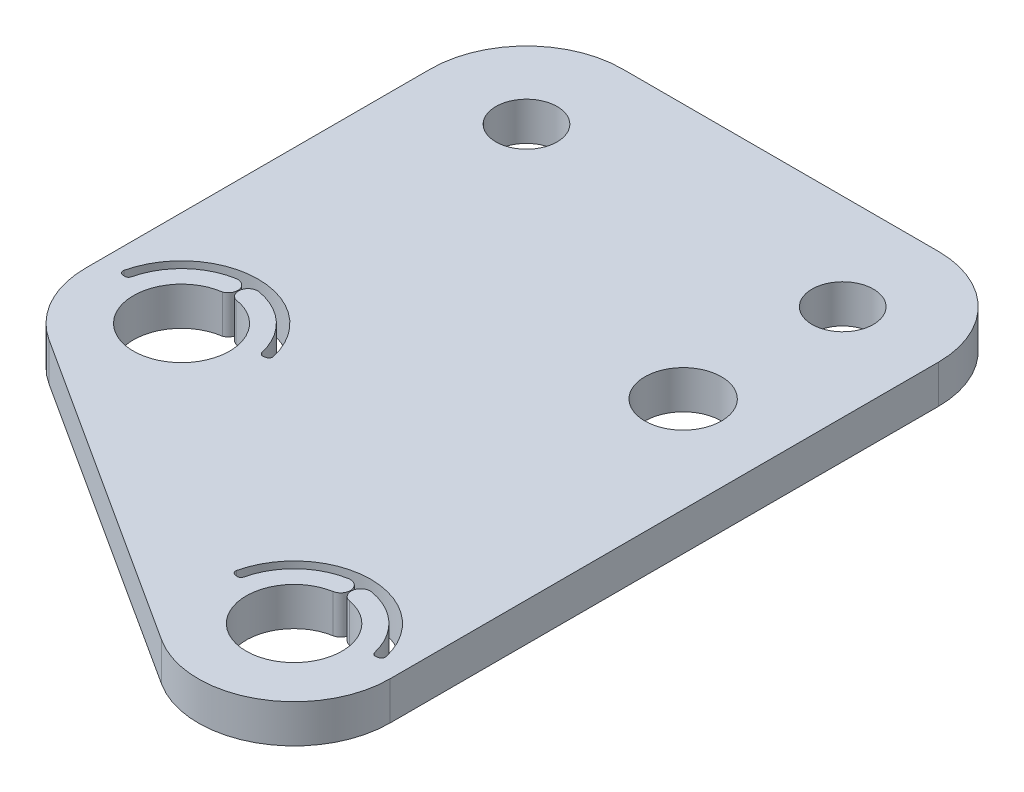
from build123d import *

# Parameters (mm, degrees)
SKETCH1_R           = 2.51
SKETCH1_R_2         = 2.5
SKETCH1_R_3         = 1.6
SKETCH1_R_4         = 2
BOSS_EXTRUDE1_DEPTH = 2
FILLET1_R           = 5
CUT_EXTRUDE2_DEPTH  = 47.884332404
SKETCH3_W           = 0.508814103
SKETCH3_H           = 0.135683761
CUT_EXTRUDE3_DEPTH  = 0.4


with BuildPart() as part:
    # Sketch1 → Boss-Extrude1 (new body)
    with BuildSketch(Plane(origin=(0, 0, 0), x_dir=(1, 0, 0), z_dir=(0, 1, 0))):
        Polygon((0, 0), (26.5, 0), (26.5, -42.791666667), (0, -25.727272727), align=None)
        with Locations(Location((5, -23, 0), (0, 0, 270))):
            Circle(SKETCH1_R, mode=Mode.SUBTRACT)
        with Locations(Location((21.5, -33.625, 0), (0, 0, 270))):
            Circle(SKETCH1_R_2, mode=Mode.SUBTRACT)
        with Locations(Location((21.5, -5, 0), (0, 0, 270))):
            Circle(SKETCH1_R_3, mode=Mode.SUBTRACT)
        with Locations(Location((5, -5, 0), (0, 0, 270))):
            Circle(SKETCH1_R_3, mode=Mode.SUBTRACT)
        with Locations(Location((21.5, -13.325, 0), (0, 0, 270))):
            Circle(SKETCH1_R_4, mode=Mode.SUBTRACT)
    extrude(amount=BOSS_EXTRUDE1_DEPTH)

    # Fillet1
    fillet1_edges = [part.edges().sort_by_distance(p)[0] for p in [
        (0, 1, 0),
        (26.5, 1, 0),
        (26.5, 1, 42.791666667),
        (0, 1, 25.727272727),
    ]]
    fillet(fillet1_edges, radius=FILLET1_R)

    # Sketch2 → Cut-Extrude2 (cut, through all)
    with BuildSketch(Plane(origin=(0, 2, 0), x_dir=(1, 0, 0), z_dir=(0, 1, 0))):
        with BuildLine():
            Line((17.861538493, -32.983441068), (17.762917332, -32.966051496))
            ThreePointArc((17.762917332, -32.966051496), (17.630853466, -32.879452656), (17.602786281, -32.724042048))
            ThreePointArc((17.602786281, -32.724042048), (21.5, -29.625), (25.397213719, -32.724042048))
            ThreePointArc((25.397213719, -32.724042048), (25.369146534, -32.879452656), (25.237082668, -32.966051496))
            Line((25.237082668, -32.966051496), (25.138461507, -32.983441068))
            ThreePointArc((25.138461507, -32.983441068), (24.993487988, -32.953351583), (24.908935554, -32.831804949))
            ThreePointArc((24.908935554, -32.831804949), (23.907056069, -31.084118051), (22.107768622, -30.178172864))
            ThreePointArc((22.107768622, -30.178172864), (21.528540656, -30.583752652), (21.934120444, -31.162980617))
            ThreePointArc((21.934120444, -31.162980617), (21.5, -31.125), (21.065879556, -31.162980617))
            ThreePointArc((21.065879556, -31.162980617), (21.471459344, -30.583752652), (20.892231378, -30.178172864))
            ThreePointArc((20.892231378, -30.178172864), (19.092943931, -31.084118051), (18.091064446, -32.831804949))
            ThreePointArc((18.091064446, -32.831804949), (18.006512012, -32.953351583), (17.861538493, -32.983441068))
        make_face()
        with BuildLine():
            Line((1.361538493, -22.358441068), (1.262917332, -22.341051496))
            ThreePointArc((1.262917332, -22.341051496), (1.130853466, -22.254452656), (1.102786281, -22.099042048))
            ThreePointArc((1.102786281, -22.099042048), (5, -19), (8.897213719, -22.099042048))
            ThreePointArc((8.897213719, -22.099042048), (8.869146534, -22.254452656), (8.737082668, -22.341051496))
            Line((8.737082668, -22.341051496), (8.638461507, -22.358441068))
            ThreePointArc((8.638461507, -22.358441068), (8.493487988, -22.328351583), (8.408935554, -22.206804949))
            ThreePointArc((8.408935554, -22.206804949), (7.407056069, -20.459118051), (5.607768622, -19.553172864))
            ThreePointArc((5.607768622, -19.553172864), (5.028540656, -19.958752652), (5.434120444, -20.537980617))
            ThreePointArc((5.434120444, -20.537980617), (5, -20.5), (4.565879556, -20.537980617))
            ThreePointArc((4.565879556, -20.537980617), (4.971459344, -19.958752652), (4.392231378, -19.553172864))
            ThreePointArc((4.392231378, -19.553172864), (2.592943931, -20.459118051), (1.591064446, -22.206804949))
            ThreePointArc((1.591064446, -22.206804949), (1.506512012, -22.328351583), (1.361538493, -22.358441068))
        make_face()
    extrude(amount=-CUT_EXTRUDE2_DEPTH, mode=Mode.SUBTRACT)

    # Sketch3 → Cut-Extrude3 (cut)
    # profile 1 of 6: a face of its own
    with BuildSketch(Plane(origin=(0, 0, 0), x_dir=(-1, 0, 0), z_dir=(0, 0, -1))):
        Polygon((-16.413127671, 0.4), (-16.238487831, 1.722916667), (-16.22152736, 1.722916667), (-15.675347222, 0.637446581), (-15.130492121, 1.722916667), (-15.113266643, 1.722916667), (-14.937566774, 0.4), (-15.056820079, 0.4), (-15.18349359, 1.351906384), (-15.661036826, 0.4), (-15.687802567, 0.4), (-16.167200855, 1.354026442), (-16.293609358, 0.4), align=None)
    # profile 2 of 6: a face of its own
    with BuildSketch(Plane(origin=(0, 0, 0), x_dir=(-1, 0, 0), z_dir=(0, 0, -1))):
        with BuildLine():
            Line((-14.666199252, 1.722916667), (-14.401456914, 1.722916667))
            add(Edge.make_bspline(
                [(-14.401456914, 1.722916667), (-14.383789881, 1.722857859), (-14.349867219, 1.722744941), (-14.301269584, 1.722115323), (-14.257111723, 1.72031073), (-14.217416724, 1.718757783), (-14.182185316, 1.715926008), (-14.151309465, 1.713219454), (-14.124931377, 1.709676433), (-14.108963451, 1.70638599), (-14.101733607, 1.704896167)],
                knots=[0, 0, 0, 0, 1.410062039, 2.707475311, 3.878576406, 4.937260626, 5.877586885, 6.699081471, 7.410979367, 8, 8, 8, 8], degree=3))
            add(Edge.make_bspline(
                [(-14.101733607, 1.704896167), (-14.092054913, 1.702504801), (-14.072903997, 1.697773082), (-14.045330609, 1.687771982), (-14.01905585, 1.676198493), (-13.994188863, 1.662605063), (-13.970854203, 1.646890786), (-13.948811271, 1.629326943), (-13.927960039, 1.610009636), (-13.909143768, 1.588451824), (-13.891401924, 1.565835048), (-13.876438366, 1.541378568), (-13.863539369, 1.515804122), (-13.85326956, 1.488851616), (-13.845000207, 1.460782434), (-13.839169456, 1.431342323), (-13.835672727, 1.400665407), (-13.835316729, 1.379741436), (-13.835136218, 1.369131861)],
                knots=[0, 0, 0, 0, 1.027469482, 2.033020251, 3.019912614, 3.986113645, 4.951240523, 5.91722682, 6.890402269, 7.87763091, 8.8651537, 9.85103654, 10.82876324, 11.815024772, 12.821070561, 13.842952187, 14.906261191, 16, 16, 16, 16], degree=3))
            add(Edge.make_bspline(
                [(-13.835136218, 1.369131861), (-13.835691464, 1.351504902), (-13.836774894, 1.317110139), (-13.846876346, 1.26719427), (-13.863422829, 1.220631642), (-13.886223596, 1.177480883), (-13.915259528, 1.13858311), (-13.950156101, 1.10441767), (-13.990932782, 1.075827584), (-14.028892672, 1.056001672), (-14.062424527, 1.043304353), (-14.090029381, 1.034370372), (-14.120141601, 1.027467784), (-14.152472677, 1.021284043), (-14.187157154, 1.016615397), (-14.224111901, 1.013196), (-14.263363274, 1.011058904), (-14.290327744, 1.010740646), (-14.304199219, 1.010576923)],
                knots=[0, 0, 0, 0, 1.260483769, 2.459530307, 3.627416485, 4.787058657, 5.939039949, 7.08810263, 8.267026773, 9.491475466, 10.141966685, 10.831826277, 11.566392101, 12.351337768, 13.187381173, 14.07005841, 15.007169909, 16, 16, 16, 16], degree=3))
            Line((-14.304199219, 1.010576923), (-13.818175748, 0.4))
            Line((-13.818175748, 0.4), (-13.964989817, 0.4))
            Line((-13.964989817, 0.4), (-14.451013288, 1.010576923))
            Line((-14.451013288, 1.010576923), (-14.547475962, 1.010576923))
            Line((-14.547475962, 1.010576923), (-14.547475962, 0.4))
            Line((-14.547475962, 0.4), (-14.666199252, 0.4))
            Line((-14.666199252, 0.4), (-14.666199252, 1.722916667))
        make_face()
        with BuildLine():
            Line((-14.547475962, 1.587232906), (-14.547475962, 1.146260684))
            Line((-14.547475962, 1.146260684), (-14.305259248, 1.144405632))
            add(Edge.make_bspline(
                [(-14.305259248, 1.144405632), (-14.293950186, 1.144400629), (-14.272030002, 1.144390932), (-14.240317548, 1.145900484), (-14.210790006, 1.14761775), (-14.183560317, 1.150244437), (-14.158616317, 1.153629619), (-14.135970473, 1.15786408), (-14.11558582, 1.162797449), (-14.09181167, 1.170433183), (-14.065263933, 1.182530696), (-14.036412459, 1.200131346), (-14.011843123, 1.222269078), (-13.991085478, 1.24758345), (-13.974405604, 1.275416199), (-13.962645988, 1.305433695), (-13.955183815, 1.336878139), (-13.95430368, 1.358490102), (-13.953859509, 1.369396868)],
                knots=[0, 0, 0, 0, 1.146690395, 2.22261258, 3.21895312, 4.145990853, 4.996080663, 5.770904154, 6.481378293, 7.121626537, 8.300444488, 9.431385265, 10.535395872, 11.636531494, 12.74115979, 13.810798291, 14.895190096, 16, 16, 16, 16], degree=3))
            add(Edge.make_bspline(
                [(-13.953859509, 1.369396868), (-13.954313882, 1.380035603), (-13.955214283, 1.401117693), (-13.962565455, 1.431981683), (-13.974996858, 1.461111155), (-13.991749609, 1.488387612), (-14.012160004, 1.513147221), (-14.036092629, 1.53433171), (-14.062893105, 1.551812907), (-14.08794204, 1.562983759), (-14.110331162, 1.569832632), (-14.129770349, 1.574652268), (-14.151735104, 1.578524434), (-14.176332078, 1.581626885), (-14.203456265, 1.584293486), (-14.233244815, 1.586089546), (-14.265500086, 1.587153119), (-14.287856218, 1.587205691), (-14.299429087, 1.587232906)],
                knots=[0, 0, 0, 0, 1.101028733, 2.181837193, 3.264309656, 4.369019818, 5.486613113, 6.575447106, 7.666700264, 8.788928104, 9.402425223, 10.0903467, 10.862060571, 11.710948788, 12.657782767, 13.684531032, 14.801375019, 16, 16, 16, 16], degree=3))
            Line((-14.299429087, 1.587232906), (-14.547475962, 1.587232906))
        make_face(mode=Mode.SUBTRACT)
    # profile 3 of 6: a face of its own
    with BuildSketch(Plane(origin=(0, 0, 0), x_dir=(-1, 0, 0), z_dir=(0, 0, -1))):
        with BuildLine():
            Line((-13.546808226, 1.722916667), (-13.287366036, 1.722916667))
            add(Edge.make_bspline(
                [(-13.287366036, 1.722916667), (-13.269521437, 1.722897051), (-13.235330394, 1.722859467), (-13.186301191, 1.721719965), (-13.141771918, 1.720197971), (-13.101838589, 1.718088148), (-13.066378338, 1.715594794), (-13.035551621, 1.712097744), (-13.009116134, 1.708446382), (-12.993276493, 1.704734124), (-12.986052684, 1.703041116)],
                knots=[0, 0, 0, 0, 1.415646017, 2.712440637, 3.8905458, 4.950247383, 5.884950622, 6.709939814, 7.411656543, 8, 8, 8, 8], degree=3))
            add(Edge.make_bspline(
                [(-12.986052684, 1.703041116), (-12.976908105, 1.700538176), (-12.958834426, 1.695591276), (-12.932791472, 1.685683113), (-12.908013679, 1.673934795), (-12.884416036, 1.660545389), (-12.862288523, 1.644940428), (-12.841301001, 1.627752484), (-12.821638688, 1.608584718), (-12.80341215, 1.587652117), (-12.78667355, 1.565306085), (-12.772261438, 1.54121304), (-12.760193707, 1.51577853), (-12.749843482, 1.489020245), (-12.742394155, 1.460713486), (-12.736782381, 1.431054937), (-12.733220474, 1.400047777), (-12.732879327, 1.378858482), (-12.732705662, 1.368071832)],
                knots=[0, 0, 0, 0, 0.999701418, 1.975846123, 2.934577507, 3.890451536, 4.834027766, 5.787354733, 6.749476667, 7.726910423, 8.712836071, 9.690891519, 10.682875813, 11.679750201, 12.712814741, 13.765529915, 14.8625177, 16, 16, 16, 16], degree=3))
            add(Edge.make_bspline(
                [(-12.732705662, 1.368071832), (-12.732864951, 1.357194517), (-12.73317661, 1.335912317), (-12.73691717, 1.304777364), (-12.741955665, 1.275023687), (-12.749703063, 1.246717258), (-12.759850088, 1.220026178), (-12.771753334, 1.194542557), (-12.786110204, 1.170699943), (-12.802606911, 1.148411777), (-12.820958257, 1.127657137), (-12.8410866, 1.108586426), (-12.862910678, 1.091311275), (-12.886361133, 1.075792954), (-12.911666581, 1.062391325), (-12.938443229, 1.05038782), (-12.966923817, 1.040306794), (-12.986632445, 1.035003765), (-12.996652978, 1.032307525)],
                knots=[0, 0, 0, 0, 1.121902311, 2.195077645, 3.232258892, 4.234102512, 5.217864754, 6.176164875, 7.132989551, 8.084763148, 9.034132444, 9.988522005, 10.94243251, 11.903244335, 12.886203696, 13.894208494, 14.929344452, 16, 16, 16, 16], degree=3))
            add(Edge.make_bspline(
                [(-12.996652978, 1.032307525), (-13.004940988, 1.03054503), (-13.023104644, 1.026682417), (-13.053018709, 1.022370292), (-13.087847471, 1.018689711), (-13.127543392, 1.015930055), (-13.172070841, 1.013567565), (-13.221453906, 1.011689743), (-13.275789524, 1.010657924), (-13.313689667, 1.010604707), (-13.333477314, 1.010576923)],
                knots=[0, 0, 0, 0, 0.601384939, 1.31797006, 2.144135048, 3.087295005, 4.142315834, 5.309527816, 6.595305764, 8, 8, 8, 8], degree=3))
            Line((-13.333477314, 1.010576923), (-13.428084936, 1.010576923))
            Line((-13.428084936, 1.010576923), (-13.428084936, 0.4))
            Line((-13.428084936, 0.4), (-13.546808226, 0.4))
            Line((-13.546808226, 0.4), (-13.546808226, 1.722916667))
        make_face()
        with BuildLine():
            Line((-13.428084936, 1.587232906), (-13.428084936, 1.146260684))
            Line((-13.428084936, 1.146260684), (-13.196468516, 1.143345603))
            add(Edge.make_bspline(
                [(-13.196468516, 1.143345603), (-13.185159497, 1.143339758), (-13.163327668, 1.143328475), (-13.131790762, 1.144834794), (-13.102531894, 1.146573686), (-13.075640939, 1.149119705), (-13.051105773, 1.152718513), (-13.028885487, 1.156351521), (-13.009152377, 1.161607417), (-12.986058333, 1.168684292), (-12.960324449, 1.18075406), (-12.932328679, 1.198273215), (-12.908602892, 1.220604316), (-12.888071869, 1.245712455), (-12.871778874, 1.273644566), (-12.85985146, 1.303530742), (-12.852843344, 1.335064482), (-12.851903622, 1.35664244), (-12.851428953, 1.367541817)],
                knots=[0, 0, 0, 0, 1.160613943, 2.240541288, 3.23993089, 4.169200891, 5.011653406, 5.7853311, 6.478053781, 7.106038997, 8.262395093, 9.384106736, 10.481365981, 11.59014053, 12.70357646, 13.786202915, 14.881775077, 16, 16, 16, 16], degree=3))
            add(Edge.make_bspline(
                [(-12.851428953, 1.367541817), (-12.851906203, 1.378177505), (-12.852854918, 1.399319937), (-12.85990639, 1.430305956), (-12.871755684, 1.45987719), (-12.888181242, 1.487459279), (-12.908116134, 1.512477071), (-12.931285826, 1.534209616), (-12.957635779, 1.551680319), (-12.982146866, 1.562956589), (-13.003918743, 1.569841529), (-13.022829633, 1.574658776), (-13.044181762, 1.578504912), (-13.067982084, 1.581619248), (-13.094046125, 1.584285289), (-13.12259781, 1.586094274), (-13.153528978, 1.587153158), (-13.175002022, 1.58720568), (-13.18613323, 1.587232906)],
                knots=[0, 0, 0, 0, 1.120700087, 2.227813068, 3.331159281, 4.466773991, 5.599788987, 6.693661531, 7.80175334, 8.91857717, 9.525282508, 10.207424825, 10.974604443, 11.810962634, 12.737642355, 13.736264703, 14.826523623, 16, 16, 16, 16], degree=3))
            Line((-13.18613323, 1.587232906), (-13.428084936, 1.587232906))
        make_face(mode=Mode.SUBTRACT)
    # profile 4 of 6: a face of its own
    with BuildSketch(Plane(origin=(0, 0, 0), x_dir=(-1, 0, 0), z_dir=(0, 0, -1))):
        with Locations((-12.325654381, 0.908814103)):
            Rectangle(SKETCH3_W, SKETCH3_H)
    # profile 5 of 6: a face of its own
    with BuildSketch(Plane(origin=(0, 0, 0), x_dir=(-1, 0, 0), z_dir=(0, 0, -1))):
        with BuildLine():
            add(Edge.make_bspline(
                [(-11.969484509, 1.060928319), (-11.969360525, 1.082131796), (-11.969119687, 1.123319855), (-11.966440432, 1.183336669), (-11.961989633, 1.239640112), (-11.955890091, 1.292232878), (-11.948467402, 1.341128545), (-11.938558572, 1.386196444), (-11.927290042, 1.427645164), (-11.91423004, 1.465609867), (-11.899493584, 1.500602035), (-11.883454444, 1.533268703), (-11.865476084, 1.563560445), (-11.846586001, 1.591960741), (-11.826019534, 1.618004697), (-11.804361955, 1.642060108), (-11.780767972, 1.663571017), (-11.756039633, 1.683167685), (-11.729953052, 1.700346503), (-11.703251807, 1.715477925), (-11.675752109, 1.728404661), (-11.647378879, 1.738568605), (-11.618387138, 1.746963776), (-11.588675539, 1.752704837), (-11.558195023, 1.756317121), (-11.537621237, 1.756662465), (-11.52718725, 1.756837607)],
                knots=[0, 0, 0, 0, 1.646270934, 3.197905019, 4.663502075, 6.030701355, 7.308322542, 8.50163776, 9.611534131, 10.641858119, 11.616356847, 12.558055219, 13.465016945, 14.349605745, 15.204443733, 16.039544428, 16.859896111, 17.680448484, 18.487036065, 19.28249412, 20.06191084, 20.843045899, 21.620316918, 22.403196591, 23.190181807, 24, 24, 24, 24], degree=3))
            add(Edge.make_bspline(
                [(-11.52718725, 1.756837607), (-11.516666101, 1.756653224), (-11.495742848, 1.756286545), (-11.464809135, 1.752762317), (-11.434590059, 1.746914601), (-11.405214453, 1.738628995), (-11.37644102, 1.728349676), (-11.348494819, 1.715465558), (-11.321202261, 1.700467891), (-11.294997063, 1.682845175), (-11.269591539, 1.663197112), (-11.245609719, 1.640986223), (-11.223049422, 1.616436775), (-11.201627506, 1.589811428), (-11.18195173, 1.560599506), (-11.163214153, 1.529309083), (-11.14644258, 1.495392953), (-11.13028989, 1.459417002), (-11.116347487, 1.420385798), (-11.103773638, 1.378519356), (-11.093614028, 1.33332316), (-11.085151416, 1.285034341), (-11.078595459, 1.23347556), (-11.073820621, 1.17875734), (-11.071298354, 1.12084368), (-11.07082335, 1.081247708), (-11.070579594, 1.060928319)],
                knots=[0, 0, 0, 0, 0.810914788, 1.612654377, 2.396697861, 3.181598691, 3.963628158, 4.749916497, 5.551656086, 6.361998678, 7.18212741, 8.025565596, 8.878627764, 9.750805457, 10.657531673, 11.591944965, 12.560506719, 13.57287815, 14.630710178, 15.753379473, 16.941251878, 18.199788006, 19.531962791, 20.947069417, 22.433333509, 24, 24, 24, 24], degree=3))
            add(Edge.make_bspline(
                [(-11.070579594, 1.060928319), (-11.070825877, 1.040697556), (-11.071305751, 1.001278739), (-11.073792345, 0.943625663), (-11.078690399, 0.889197831), (-11.084817389, 0.837864709), (-11.093303318, 0.789839955), (-11.103737414, 0.74495738), (-11.115322506, 0.703023163), (-11.129623158, 0.664380838), (-11.14527542, 0.628491348), (-11.162305211, 0.594977277), (-11.180550056, 0.563542398), (-11.20042735, 0.534438327), (-11.221614206, 0.507458894), (-11.244564084, 0.483080329), (-11.268630049, 0.460715224), (-11.294110337, 0.440814162), (-11.320724227, 0.423395203), (-11.347923045, 0.407817349), (-11.376189383, 0.395256181), (-11.404882672, 0.384470615), (-11.434413334, 0.376230564), (-11.464744559, 0.370533005), (-11.495722065, 0.366537098), (-11.516662538, 0.366232268), (-11.52718725, 0.36607906)],
                knots=[0, 0, 0, 0, 1.561518951, 3.042555995, 4.452378317, 5.7783523, 7.031515105, 8.214008947, 9.334062868, 10.386615937, 11.391082383, 12.354592575, 13.286541444, 14.194233754, 15.072674879, 15.931287219, 16.775624067, 17.606195743, 18.42308326, 19.229000347, 20.022332153, 20.807536673, 21.593273796, 22.3848459, 23.188221202, 24, 24, 24, 24], degree=3))
            add(Edge.make_bspline(
                [(-11.52718725, 0.36607906), (-11.537620947, 0.366255331), (-11.558194163, 0.366602904), (-11.58867886, 0.370198868), (-11.618267759, 0.375980204), (-11.647106872, 0.38407517), (-11.675344156, 0.393983754), (-11.702594835, 0.406893033), (-11.729161906, 0.421760375), (-11.754974489, 0.438691978), (-11.779547538, 0.458090352), (-11.803019332, 0.479545901), (-11.824800217, 0.503594036), (-11.845072628, 0.529855037), (-11.86433962, 0.558087304), (-11.882062687, 0.588676302), (-11.898455837, 0.621500741), (-11.913440132, 0.65677269), (-11.92672549, 0.695006844), (-11.938460785, 0.736640611), (-11.947726553, 0.782041461), (-11.95565761, 0.830844752), (-11.962054624, 0.883260196), (-11.966421884, 0.939316249), (-11.969121131, 0.99897798), (-11.969361172, 1.039901376), (-11.969484509, 1.060928319)],
                knots=[0, 0, 0, 0, 0.810891512, 1.598919785, 2.382837074, 3.152667961, 3.926044502, 4.706494248, 5.493654104, 6.291793342, 7.103789334, 7.925228297, 8.761435821, 9.622817696, 10.50288917, 11.416980706, 12.369136599, 13.353924996, 14.394355917, 15.514179734, 16.714354668, 17.994756427, 19.357759367, 20.818452758, 22.365282078, 24, 24, 24, 24], degree=3))
        make_face()
        with BuildLine():
            add(Edge.make_bspline(
                [(-11.850761218, 1.061458333), (-11.85071607, 1.043788438), (-11.850628446, 1.009494642), (-11.848339346, 0.959661028), (-11.845220955, 0.913181172), (-11.841198798, 0.869996055), (-11.83522566, 0.830251854), (-11.828532916, 0.793675218), (-11.820388251, 0.760459715), (-11.810751741, 0.730377417), (-11.799775654, 0.702917799), (-11.787791592, 0.677366149), (-11.77491745, 0.653420626), (-11.760509319, 0.631296315), (-11.744817613, 0.610921069), (-11.728196768, 0.591934254), (-11.710026476, 0.575002062), (-11.684889645, 0.55469459), (-11.651704668, 0.533709679), (-11.60989277, 0.515436008), (-11.566928802, 0.503952163), (-11.537767466, 0.502491755), (-11.523212139, 0.501762821)],
                knots=[0, 0, 0, 0, 1.459021318, 2.831673884, 4.118529203, 5.306027144, 6.411944654, 7.436330062, 8.375795394, 9.233974572, 10.042671642, 10.816086306, 11.563610507, 12.285937304, 12.993564865, 13.685989202, 14.367179055, 15.041617293, 16.353048772, 17.594441528, 18.799311195, 20, 20, 20, 20], degree=3))
            add(Edge.make_bspline(
                [(-11.523212139, 0.501762821), (-11.508562662, 0.502366744), (-11.479293954, 0.503573343), (-11.436532073, 0.515214532), (-11.395018846, 0.532778912), (-11.362485702, 0.553547761), (-11.337734859, 0.573326623), (-11.320001354, 0.590189898), (-11.303724925, 0.609072026), (-11.288287593, 0.629444677), (-11.274128955, 0.651697074), (-11.2612539, 0.675722214), (-11.249505134, 0.701586814), (-11.242811537, 0.719642638), (-11.239389273, 0.728874115)],
                knots=[0, 0, 0, 0, 1.353760809, 2.704726607, 4.075137775, 5.516104923, 6.260822281, 7.007110065, 7.778089737, 8.566572457, 9.372053459, 10.217411131, 11.088608312, 12, 12, 12, 12], degree=3))
            add(Edge.make_bspline(
                [(-11.239389273, 0.728874115), (-11.235400956, 0.740678213), (-11.227302962, 0.764645594), (-11.216866369, 0.801824713), (-11.208647126, 0.8408329), (-11.201252639, 0.881437037), (-11.196205502, 0.923936567), (-11.192143084, 0.968199991), (-11.189750235, 1.014260685), (-11.189453618, 1.04555522), (-11.189302885, 1.061458333)],
                knots=[0, 0, 0, 0, 0.884706709, 1.796334032, 2.740027952, 3.714592787, 4.726048262, 5.777819803, 6.87074269, 8, 8, 8, 8], degree=3))
            add(Edge.make_bspline(
                [(-11.189302885, 1.061458333), (-11.189510843, 1.077358874), (-11.189917654, 1.108463731), (-11.191472644, 1.154016734), (-11.195488102, 1.197282822), (-11.199947888, 1.238448388), (-11.206523623, 1.277285556), (-11.213613628, 1.314119451), (-11.223139086, 1.348493749), (-11.23331412, 1.380946626), (-11.244959716, 1.411109374), (-11.257779056, 1.43912262), (-11.271470018, 1.465121609), (-11.286340448, 1.489035006), (-11.302213817, 1.510969926), (-11.319509081, 1.530486573), (-11.337540198, 1.548189832), (-11.362795503, 1.56839741), (-11.395858702, 1.589001533), (-11.436999765, 1.607962996), (-11.479813372, 1.618851845), (-11.508756314, 1.620387066), (-11.523212139, 1.621153846)],
                knots=[0, 0, 0, 0, 1.31362396, 2.569729283, 3.763502607, 4.902122613, 5.988968491, 7.01645872, 7.998833611, 8.933434873, 9.825090667, 10.667526885, 11.477055099, 12.250526234, 12.991942729, 13.710640831, 14.402115721, 15.076753259, 16.378508321, 17.609869233, 18.806226677, 20, 20, 20, 20], degree=3))
            add(Edge.make_bspline(
                [(-11.523212139, 1.621153846), (-11.537843822, 1.620386008), (-11.567133841, 1.618848932), (-11.610392443, 1.608003565), (-11.651858076, 1.589099855), (-11.684833843, 1.568329167), (-11.710106763, 1.548546531), (-11.7279029, 1.531391532), (-11.744589102, 1.51262643), (-11.759960524, 1.492063801), (-11.774357366, 1.469965284), (-11.787579356, 1.446157031), (-11.799492156, 1.420518391), (-11.810485418, 1.393071107), (-11.820151323, 1.362991405), (-11.828124339, 1.329816815), (-11.835489981, 1.293356516), (-11.840704265, 1.25339706), (-11.845339672, 1.210201127), (-11.848318634, 1.163605235), (-11.850636104, 1.113688044), (-11.850718678, 1.079216934), (-11.850761218, 1.061458333)],
                knots=[0, 0, 0, 0, 1.207732386, 2.417664972, 3.655092373, 4.956220595, 5.625982001, 6.301752483, 6.994047911, 7.697131622, 8.419323945, 9.170223765, 9.943494443, 10.752040957, 11.610060368, 12.549350801, 13.567764191, 14.679664412, 15.874934091, 17.154273443, 18.533957287, 20, 20, 20, 20], degree=3))
        make_face(mode=Mode.SUBTRACT)
    # profile 6 of 6: a face of its own
    with BuildSketch(Plane(origin=(0, 0, 0), x_dir=(-1, 0, 0), z_dir=(0, 0, -1))):
        Polygon((-10.67068351, 1.722916667), (-10.426081731, 1.722916667), (-10.426081731, 0.4), (-10.544805021, 0.4), (-10.544805021, 1.587232906), (-10.748330662, 1.587232906), align=None)
    extrude(amount=-CUT_EXTRUDE3_DEPTH, mode=Mode.SUBTRACT)


solid = part.part
